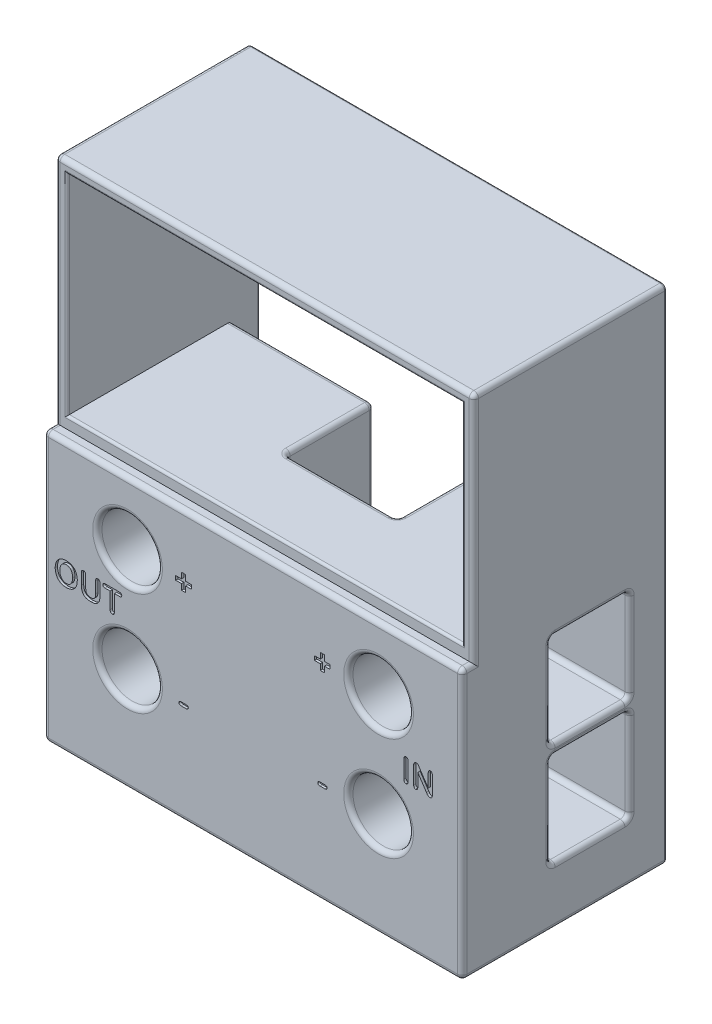
from build123d import *

# Parameters (mm, degrees)
SKETCH2_W               = 87.999717
SKETCH2_H               = 108
SKETCH2_R               = 6.5
SKETCH2_W_2             = 63.5
SKETCH2_H_2             = 21.25
BOSS_EXTRUDE1_DEPTH     = 46
SKETCH4_W               = 63.5
SKETCH4_H               = 21.25
BOSS_EXTRUDE2_DEPTH     = 44
BOSS_EXTRUDE3_START     = -10
SKETCH5_R               = 6.5
BOSS_EXTRUDE3_DEPTH     = 10
BOSS_EXTRUDE4_DEPTH     = 46
CUT_EXTRUDE1_START      = -45
SKETCH3_W               = 2
SKETCH3_H               = 20
CUT_EXTRUDE1_DEPTH      = 28
CUT_EXTRUDE2_START      = 45
SKETCH3_3_W             = 2
SKETCH3_3_H             = 20
CUT_EXTRUDE2_DEPTH      = 28
SKETCH6_W               = 85
SKETCH6_H               = 45
SKETCH6_W_2             = 63.5
SKETCH6_H_2             = 21.25
CUT_EXTRUDE4_DEPTH      = 85.00595217
SKETCH8_R               = 4.25
CUT_EXTRUDE5_DEPTH      = 79.974679487
SKETCH9_W               = 85
SKETCH9_H               = 103
CUT_EXTRUDE6_DEPTH      = 8
SKETCH6_4_W             = 90
SKETCH6_4_H             = 50
SKETCH6_4_W_2           = 85
SKETCH6_4_H_2           = 45
CUT_EXTRUDE7_DEPTH      = 2.5
CUT_EXTRUDE8_DEPTH      = 85.00595217
CUT_EXTRUDE8_DEPTH_BACK = 85.00595217
SKETCH10_W              = 2
SKETCH10_H              = 108
FILLET2_R               = 1
FILLET3_R               = 0.5
SKETCH11_W              = 24
SKETCH11_H              = 58
CUT_EXTRUDE9_DEPTH      = 19
FILLET4_R               = 1
CUT_EXTRUDE10_DEPTH     = 0.5


with BuildPart() as part:
    # Sketch2 → Boss-Extrude1 (new body)
    with BuildSketch(Plane.XY):
        Rectangle(SKETCH2_W, SKETCH2_H)
        with Locations((-27, -9.375)):
            Circle(SKETCH2_R, mode=Mode.SUBTRACT)
        with Locations((27, -9.375)):
            Circle(SKETCH2_R, mode=Mode.SUBTRACT)
        with Locations((27, -31.625)):
            Circle(SKETCH2_R, mode=Mode.SUBTRACT)
        with Locations((-27, -31.625)):
            Circle(SKETCH2_R, mode=Mode.SUBTRACT)
        with Locations((0, 32.5)):
            Rectangle(SKETCH2_W_2, SKETCH2_H_2, mode=Mode.SUBTRACT)
    extrude(amount=-BOSS_EXTRUDE1_DEPTH)

    # Sketch4 → Boss-Extrude2 (add)
    with BuildSketch(Plane(origin=(0, 0, -46), x_dir=(-1, 0, 0), z_dir=(0, 0, -1))):
        with Locations((0, 32.5)):
            Rectangle(SKETCH4_W, SKETCH4_H)
    extrude(amount=-BOSS_EXTRUDE2_DEPTH)

    # Sketch5 → Boss-Extrude3 (add)
    with BuildSketch(Plane(origin=(0, 0, -46), x_dir=(-1, 0, 0), z_dir=(0, 0, -1)).offset(BOSS_EXTRUDE3_START)):
        with Locations(Location((-27, -9.375, 0), (0, 0, 180))):
            Circle(SKETCH5_R)
        with Locations(Location((-27, -31.625, 0), (0, 0, 180))):
            Circle(SKETCH5_R)
        with Locations(Location((27, -31.625, 0), (0, 0, 180))):
            Circle(SKETCH5_R)
        with Locations(Location((27, -9.375, 0), (0, 0, 180))):
            Circle(SKETCH5_R)
    extrude(amount=BOSS_EXTRUDE3_DEPTH)

    # Sketch7 → Boss-Extrude4 (add)
    with BuildSketch(Plane.XY):
        Polygon((45, 54), (43.9998585, 52.7998302), (43.9998585, -54), (45, -54), align=None)
        Polygon((-45, 54), (-45, -54), (-43.9998585, -52.7998302), (-43.9998585, 54), align=None)
        Polygon((43.9998585, 54), (43.9998585, 52.7998302), (45, 54), align=None)
        Polygon((-43.9998585, -52.7998302), (-45, -54), (-43.9998585, -54), align=None)
    extrude(amount=-BOSS_EXTRUDE4_DEPTH)

    # Sketch3 → Cut-Extrude1 (cut)
    with BuildSketch(Plane(origin=(0, 0, 0), x_dir=(0, 0, -1), z_dir=(1, 0, 0)).offset(CUT_EXTRUDE1_START)):
        with BuildLine():
            Line((34, -1.125), (34, 0.625))
            Line((34, 0.625), (19, 0.625))
            Line((19, 0.625), (19, -19.375))
            Line((19, -19.375), (34, -19.375))
            Line((34, -19.375), (34, -17.625))
            ThreePointArc((34, -17.625), (27.5, -9.375), (34, -1.125))
        make_face()
        with Locations((35, -9.375)):
            Rectangle(SKETCH3_W, SKETCH3_H)
        with BuildLine():
            Line((34, -21.625), (19, -21.625))
            Line((19, -21.625), (19, -41.625))
            Line((19, -41.625), (34, -41.625))
            Line((34, -41.625), (34, -39.875))
            ThreePointArc((34, -39.875), (27.5, -31.625), (34, -23.375))
            Line((34, -23.375), (34, -21.625))
        make_face()
        with BuildLine():
            Line((34, -39.875), (34, -23.375))
            ThreePointArc((34, -23.375), (27.5, -31.625), (34, -39.875))
        make_face()
        with Locations((35, -31.625)):
            Rectangle(SKETCH3_W, SKETCH3_H)
        with BuildLine():
            Line((34, -17.625), (34, -1.125))
            ThreePointArc((34, -1.125), (27.5, -9.375), (34, -17.625))
        make_face()
    extrude(amount=CUT_EXTRUDE1_DEPTH, mode=Mode.SUBTRACT)

    # Sketch3<3> → Cut-Extrude2 (cut)
    with BuildSketch(Plane(origin=(0, 0, 0), x_dir=(0, 0, -1), z_dir=(1, 0, 0)).offset(CUT_EXTRUDE2_START)):
        with BuildLine():
            Line((34, -1.125), (34, 0.625))
            Line((34, 0.625), (19, 0.625))
            Line((19, 0.625), (19, -19.375))
            Line((19, -19.375), (34, -19.375))
            Line((34, -19.375), (34, -17.625))
            ThreePointArc((34, -17.625), (27.5, -9.375), (34, -1.125))
        make_face()
        with BuildLine():
            Line((34, -17.625), (34, -1.125))
            ThreePointArc((34, -1.125), (27.5, -9.375), (34, -17.625))
        make_face()
        with Locations((35, -9.375)):
            Rectangle(SKETCH3_3_W, SKETCH3_3_H)
        with Locations((35, -31.625)):
            Rectangle(SKETCH3_3_W, SKETCH3_3_H)
        with BuildLine():
            Line((34, -39.875), (34, -23.375))
            ThreePointArc((34, -23.375), (27.5, -31.625), (34, -39.875))
        make_face()
        with BuildLine():
            Line((34, -21.625), (19, -21.625))
            Line((19, -21.625), (19, -41.625))
            Line((19, -41.625), (34, -41.625))
            Line((34, -41.625), (34, -39.875))
            ThreePointArc((34, -39.875), (27.5, -31.625), (34, -23.375))
            Line((34, -23.375), (34, -21.625))
        make_face()
    extrude(amount=-CUT_EXTRUDE2_DEPTH, mode=Mode.SUBTRACT)

    # Sketch6 → Cut-Extrude4 (cut, through all)
    # profile 1 of 2: a face of its own
    with BuildSketch(Plane.XY):
        with Locations((0, 29)):
            Rectangle(SKETCH6_W, SKETCH6_H)
        with Locations((0, 32.5)):
            Rectangle(SKETCH6_W_2, SKETCH6_H_2, mode=Mode.SUBTRACT)
    # profile 2 of 2: a face of its own
    with BuildSketch(Plane.XY):
        with Locations((0, 32.5)):
            Rectangle(SKETCH6_W_2, SKETCH6_H_2)
    extrude(amount=-CUT_EXTRUDE4_DEPTH, mode=Mode.SUBTRACT)

    # Sketch8 → Cut-Extrude5 (cut, through all)
    with BuildSketch(Plane.XY.offset(-36)):
        with Locations((-27, -9.375)):
            Circle(SKETCH8_R)
        with Locations((-27, -31.625)):
            Circle(SKETCH8_R)
        with Locations((27, -31.625)):
            Circle(SKETCH8_R)
        with Locations((27, -9.375)):
            Circle(SKETCH8_R)
    extrude(amount=-CUT_EXTRUDE5_DEPTH, mode=Mode.SUBTRACT)

    # Sketch9 → Cut-Extrude6 (cut)
    with BuildSketch(Plane(origin=(0, 0, -46), x_dir=(-1, 0, 0), z_dir=(0, 0, -1))):
        Rectangle(SKETCH9_W, SKETCH9_H)
    extrude(amount=-CUT_EXTRUDE6_DEPTH, mode=Mode.SUBTRACT)

    # Sketch6<4> → Cut-Extrude7 (cut)
    with BuildSketch(Plane.XY):
        with Locations((0, 29)):
            Rectangle(SKETCH6_4_W, SKETCH6_4_H)
        with Locations((0, 29)):
            Rectangle(SKETCH6_4_W_2, SKETCH6_4_H_2, mode=Mode.SUBTRACT)
    extrude(amount=-CUT_EXTRUDE7_DEPTH, mode=Mode.SUBTRACT)

    # Sketch10 → Cut-Extrude8 (cut, two sides: drawn at the far end of the back side and taken through both)
    with BuildSketch(Plane(origin=(0, 0, 0), x_dir=(0, 0, -1), z_dir=(1, 0, 0)).offset(-CUT_EXTRUDE8_DEPTH_BACK)):
        with Locations((45, 0)):
            Rectangle(SKETCH10_W, SKETCH10_H)
    extrude(amount=CUT_EXTRUDE8_DEPTH + CUT_EXTRUDE8_DEPTH_BACK, mode=Mode.SUBTRACT)

    # Fillet2
    fillet2_edges = [part.edges().sort_by_distance(p)[0] for p in [
        (-17, -31.625, -19),
        (-31, -21.625, -19),
        (-33.5, -31.625, -19),
        (-17, -31.625, -36),
        (-31, -41.625, -36),
        (-17, -41.625, -27.5),
        (-31, -41.625, -19),
        (-45, -21.625, -27.5),
        (-31, -21.625, -36),
        (-17, -21.625, -27.5),
        (-45, -31.625, -19),
        (-45, -31.625, -36),
        (-45, -41.625, -27.5),
        (-45, -9.375, -19),
        (-31, 0.625, -19),
        (-45, -9.375, -36),
        (-31, -19.375, -36),
        (-33.5, -9.375, -19),
        (-17, -19.375, -27.5),
        (-31, -19.375, -19),
        (-45, 0.625, -27.5),
        (-31, 0.625, -36),
        (-17, -9.375, -19),
        (-17, -9.375, -36),
        (-17, 0.625, -27.5),
        (-45, -19.375, -27.5),
        (45, -9.375, -36),
        (31, 0.625, -36),
        (45, -9.375, -19),
        (31, -19.375, -19),
        (17, -19.375, -27.5),
        (31, -19.375, -36),
        (20.5, -9.375, -19),
        (45, 0.625, -27.5),
        (31, 0.625, -19),
        (17, -9.375, -36),
        (17, -9.375, -19),
        (17, 0.625, -27.5),
        (45, -19.375, -27.5),
        (17, -31.625, -19),
        (31, -41.625, -19),
        (20.5, -31.625, -19),
        (17, -31.625, -36),
        (31, -21.625, -36),
        (45, -41.625, -27.5),
        (31, -41.625, -36),
        (17, -21.625, -27.5),
        (31, -21.625, -19),
        (17, -41.625, -27.5),
        (45, -31.625, -36),
        (45, -21.625, -27.5),
        (45, -31.625, -19),
        (0, -54, 0),
        (22.75, -9.375, -36),
        (20.5, -31.625, 0),
        (22.75, -31.625, -36),
        (-31.25, -31.625, -36),
        (-31.25, -9.375, -36),
        (20.5, -9.375, 0),
        (-33.5, -31.625, 0),
        (-33.5, -9.375, 0),
        (0, 6.5, -38),
        (-45, -25, 0),
        (45, -25, 0),
        (-45, 29, -2.5),
        (-45, 4, -1.25),
        (0, 54, -2.5),
        (45, 29, -2.5),
        (45, 4, -1.25),
        (0, 4, 0),
        (-45, -54, -22),
        (45, -54, -22),
        (-45, 54, -23.25),
        (45, 54, -23.25),
    ]]
    fillet(fillet2_edges, radius=FILLET2_R)

    # Fillet3
    fillet3_edges = [part.edges().sort_by_distance(p)[0] for p in [
        (22.75, -31.625, -38),
        (22.75, -9.375, -38),
        (-31.25, -9.375, -38),
        (-31.25, -31.625, -38),
        (0, 51.5, -2.5),
        (-42.5, 29, -2.5),
        (0, 6.5, -2.5),
        (42.5, 29, -2.5),
        (0, -51.5, -44),
        (42.5, 0, -44),
        (0, 51.5, -44),
        (-42.5, 0, -44),
        (-45, 0, -44),
        (45, 0, -44),
        (0, -54, -44),
        (0, 54, -44),
        (44.707106781, 53.707106781, -44),
        (-44.707106781, 53.707106781, -44),
        (-44.707106781, -53.707106781, -44),
        (44.707106781, -53.707106781, -44),
    ]]
    fillet(fillet3_edges, radius=FILLET3_R)

    # Sketch11 → Cut-Extrude9 (cut)
    with BuildSketch(Plane(origin=(0, 0, -38), x_dir=(-1, 0, 0), z_dir=(0, 0, -1))):
        with Locations((0, -22.5)):
            Rectangle(SKETCH11_W, SKETCH11_H)
    extrude(amount=-CUT_EXTRUDE9_DEPTH, mode=Mode.SUBTRACT)

    # Fillet4
    fillet4_edges = [part.edges().sort_by_distance(p)[0] for p in [
        (12, 6.207106781, -37.707106781),
        (-12, 6.207106781, -37.707106781),
        (-12, -23, -38),
        (12, -23, -38),
        (-12, 6.5, -28),
        (12, 6.5, -28),
        (-12, -22.5, -19),
        (0, -51.5, -19),
        (12, -22.5, -19),
        (0, 6.5, -19),
    ]]
    fillet(fillet4_edges, radius=FILLET4_R)

    # Sketch12 → Cut-Extrude10 (cut)
    # profile 1 of 9: a face of its own
    with BuildSketch(Plane.XY):
        with BuildLine():
            add(Edge.make_bspline(
                [(-40.204101563, -18.0625), (-40.142219014, -18.063368709), (-40.020879099, -18.065072082), (-39.842278019, -18.0805127), (-39.670025809, -18.103431299), (-39.504239086, -18.136420072), (-39.345329126, -18.179465633), (-39.193265668, -18.232369375), (-39.047852761, -18.294956068), (-38.908920342, -18.365997783), (-38.77799459, -18.446416769), (-38.654241911, -18.534359089), (-38.539064026, -18.631114909), (-38.43219245, -18.735834907), (-38.334309043, -18.848804815), (-38.243990785, -18.969397378), (-38.161933411, -19.098290949), (-38.089020705, -19.23545814), (-38.023513565, -19.378849399), (-37.966648985, -19.528884986), (-37.919187553, -19.684929266), (-37.879709879, -19.847240726), (-37.849789796, -20.015581804), (-37.828714559, -20.190346757), (-37.81412411, -20.370846257), (-37.813046628, -20.493459783), (-37.8125, -20.555664063)],
                knots=[0, 0, 0, 0, 1.137132438, 2.22970057, 3.292424762, 4.329649132, 5.333981859, 6.315987487, 7.286185149, 8.241436353, 9.181332131, 10.107725602, 11.0292572, 11.943085262, 12.854854597, 13.773819033, 14.709898734, 15.660115542, 16.626635295, 17.605574315, 18.606712189, 19.622473761, 20.67399022, 21.747038223, 22.857027702, 24, 24, 24, 24], degree=3))
            add(Edge.make_bspline(
                [(-37.8125, -20.555664063), (-37.814407642, -20.646879139), (-37.818150658, -20.825853777), (-37.846542647, -21.087869401), (-37.894672643, -21.337285549), (-37.96022212, -21.574001048), (-38.046378281, -21.796377097), (-38.151196568, -22.00412166), (-38.275708195, -22.196231979), (-38.418571732, -22.372534386), (-38.57924091, -22.5320302), (-38.758813404, -22.671073825), (-38.956175636, -22.789747841), (-39.169574475, -22.889709328), (-39.400288076, -22.968467406), (-39.647849295, -23.021416856), (-39.910729065, -23.057454879), (-40.09166815, -23.060788415), (-40.184570313, -23.0625)],
                knots=[0, 0, 0, 0, 1.119700056, 2.196982321, 3.230778928, 4.235358115, 5.208318876, 6.153781848, 7.087131445, 8.013361148, 8.934611457, 9.860297843, 10.794468433, 11.756326826, 12.748403726, 13.780058436, 14.860183413, 16, 16, 16, 16], degree=3))
            add(Edge.make_bspline(
                [(-40.184570313, -23.0625), (-40.276803124, -23.06027942), (-40.457365589, -23.055932231), (-40.720582827, -23.021097135), (-40.969461773, -22.965059913), (-41.20258146, -22.884937151), (-41.418313513, -22.78290435), (-41.617562497, -22.664138614), (-41.796462748, -22.523837845), (-41.957312206, -22.366006832), (-42.100098053, -22.190396648), (-42.221488428, -21.996136894), (-42.328544833, -21.787455566), (-42.413165738, -21.561257329), (-42.480490707, -21.32244949), (-42.5279401, -21.072812122), (-42.556870777, -20.813835192), (-42.56060378, -20.638096536), (-42.5625, -20.548828125)],
                knots=[0, 0, 0, 0, 1.130091603, 2.212359386, 3.247930852, 4.252250901, 5.226719473, 6.16821431, 7.089197795, 8.00610207, 8.925165125, 9.855999165, 10.808795857, 11.79501972, 12.810514548, 13.846493258, 14.906102224, 16, 16, 16, 16], degree=3))
            add(Edge.make_bspline(
                [(-42.5625, -20.548828125), (-42.560779931, -20.457917793), (-42.557397661, -20.279155552), (-42.52617064, -20.017250939), (-42.476867474, -19.76650569), (-42.406593898, -19.528182138), (-42.317493046, -19.303954514), (-42.20934334, -19.096268157), (-42.084128705, -18.905766816), (-41.941020547, -18.732813051), (-41.779791607, -18.578459843), (-41.601343885, -18.443470626), (-41.406555768, -18.327351299), (-41.195418304, -18.231841316), (-40.968892091, -18.155181952), (-40.727036042, -18.101058131), (-40.470304863, -18.068269124), (-40.294370818, -18.064456304), (-40.204101563, -18.0625)],
                knots=[0, 0, 0, 0, 1.125218611, 2.212582392, 3.260701818, 4.286054269, 5.284468473, 6.243521648, 7.180287843, 8.101949555, 9.017004541, 9.937572836, 10.866572707, 11.818894766, 12.801573564, 13.82236102, 14.882684417, 16, 16, 16, 16], degree=3))
        make_face()
        with BuildLine():
            add(Edge.make_bspline(
                [(-38.8125, -20.548828125), (-38.814409711, -20.461806319), (-38.818107355, -20.293311934), (-38.850878723, -20.049572404), (-38.903958219, -19.823491976), (-38.967222357, -19.648437478), (-39.027971578, -19.51867883), (-39.077585349, -19.428366426), (-39.130955162, -19.343341598), (-39.191528722, -19.266437061), (-39.254362066, -19.193984208), (-39.322390378, -19.127691549), (-39.395732164, -19.068546163), (-39.498508546, -18.996758293), (-39.636913927, -18.922373447), (-39.815617192, -18.858633433), (-40.006108222, -18.819354309), (-40.137179526, -18.814816767), (-40.204101563, -18.8125)],
                knots=[0, 0, 0, 0, 1.663767962, 3.22144036, 4.693807908, 6.09809827, 6.772124886, 7.43249818, 8.068074837, 8.689496673, 9.30272399, 9.901527182, 10.503429657, 11.102750509, 12.297797107, 13.495176895, 14.721094103, 16, 16, 16, 16], degree=3))
            add(Edge.make_bspline(
                [(-40.204101563, -18.8125), (-40.252038776, -18.813692449), (-40.346782105, -18.816049209), (-40.485861893, -18.838431131), (-40.619461179, -18.87343406), (-40.746958383, -18.922391316), (-40.86721804, -18.984912243), (-40.979702156, -19.060816842), (-41.083054339, -19.149809619), (-41.177853092, -19.25153021), (-41.263531901, -19.367003595), (-41.339544956, -19.497427585), (-41.40577496, -19.642803935), (-41.462238579, -19.801835484), (-41.506895778, -19.973704465), (-41.538649307, -20.156608918), (-41.558596828, -20.349495293), (-41.561179593, -20.481395653), (-41.5625, -20.548828125)],
                knots=[0, 0, 0, 0, 0.926902171, 1.831933723, 2.71800685, 3.595261319, 4.468550136, 5.334998465, 6.214894287, 7.1017058, 8.020008637, 8.99111482, 10.01694856, 11.106630737, 12.25237115, 13.448355624, 14.695502513, 16, 16, 16, 16], degree=3))
            add(Edge.make_bspline(
                [(-41.5625, -20.548828125), (-41.561175948, -20.616910417), (-41.558585554, -20.750107531), (-41.538678745, -20.94495126), (-41.506717933, -21.130076126), (-41.462379635, -21.304715937), (-41.405018449, -21.466834698), (-41.336159513, -21.614946915), (-41.258965571, -21.750109054), (-41.167899319, -21.868552345), (-41.069532555, -21.973072777), (-40.963817326, -22.06410939), (-40.851516456, -22.141662991), (-40.731554552, -22.204799085), (-40.604589267, -22.252170855), (-40.472024127, -22.288072541), (-40.332998529, -22.308578568), (-40.238345748, -22.311182043), (-40.190429688, -22.3125)],
                knots=[0, 0, 0, 0, 1.300369924, 2.54406124, 3.737115199, 4.88637188, 5.981883645, 7.016846829, 8.003376514, 8.948590554, 9.863559023, 10.741055788, 11.608647785, 12.46534091, 13.323432129, 14.192248925, 15.0848625, 16, 16, 16, 16], degree=3))
            add(Edge.make_bspline(
                [(-40.190429688, -22.3125), (-40.128714879, -22.310432989), (-40.007115757, -22.306360277), (-39.829062488, -22.268333598), (-39.65894479, -22.208545464), (-39.524248456, -22.139704674), (-39.422731166, -22.071892244), (-39.349371171, -22.014681888), (-39.281172171, -21.949579237), (-39.216166088, -21.879097392), (-39.155929432, -21.801699497), (-39.098897641, -21.718367101), (-39.046241602, -21.628209325), (-38.997525615, -21.53173024), (-38.95353172, -21.42910536), (-38.915158866, -21.320607226), (-38.884568811, -21.205758865), (-38.857870644, -21.085626874), (-38.837560064, -20.959421065), (-38.823117244, -20.827745953), (-38.814067885, -20.690231108), (-38.81303074, -20.596694032), (-38.8125, -20.548828125)],
                knots=[0, 0, 0, 0, 1.468568495, 2.893578421, 4.316075305, 5.755382189, 6.482330971, 7.222315454, 7.968369796, 8.725783183, 9.504530818, 10.302500265, 11.129737207, 11.9897977, 12.875655565, 13.787998707, 14.728608307, 15.705132475, 16.718642732, 17.771954593, 18.859838044, 20, 20, 20, 20], degree=3))
        make_face(mode=Mode.SUBTRACT)
    # profile 2 of 9: a face of its own
    with BuildSketch(Plane.XY):
        with BuildLine():
            Line((-36.9375, -20.981445313), (-36.9375, -18.65625))
            add(Edge.make_bspline(
                [(-36.9375, -18.65625), (-36.936347915, -18.609560537), (-36.934186191, -18.521954458), (-36.909347602, -18.399701183), (-36.870478375, -18.295100271), (-36.81330714, -18.209823291), (-36.743514772, -18.143210616), (-36.661901868, -18.096558932), (-36.571075194, -18.066512432), (-36.506755039, -18.06386389), (-36.473632813, -18.0625)],
                knots=[0, 0, 0, 0, 1.314006093, 2.465543923, 3.499702682, 4.438645347, 5.334276599, 6.193453487, 7.069703068, 8, 8, 8, 8], degree=3))
            add(Edge.make_bspline(
                [(-36.473632813, -18.0625), (-36.438939423, -18.064363054), (-36.372286212, -18.067942368), (-36.277450995, -18.095840638), (-36.194605213, -18.143871779), (-36.123835804, -18.210848219), (-36.067342536, -18.296948281), (-36.027775176, -18.402193177), (-36.003534117, -18.525270354), (-36.001222859, -18.613483661), (-36, -18.66015625)],
                knots=[0, 0, 0, 0, 0.96282878, 1.849794185, 2.716851436, 3.599658085, 4.532680285, 5.552030856, 6.704809248, 8, 8, 8, 8], degree=3))
            Line((-36, -18.66015625), (-36, -21.053710938))
            add(Edge.make_bspline(
                [(-36, -21.053710938), (-35.99889066, -21.119176272), (-35.996767426, -21.244474345), (-35.980352355, -21.424389171), (-35.952620356, -21.587521133), (-35.913468807, -21.734879035), (-35.858654871, -21.866513437), (-35.785781742, -21.982442862), (-35.694423845, -22.082436057), (-35.604389303, -22.152348162), (-35.523320188, -22.198607116), (-35.455881093, -22.22899436), (-35.38297238, -22.255675736), (-35.303537405, -22.275251537), (-35.21924944, -22.292442399), (-35.128794967, -22.303466192), (-35.032714084, -22.312002141), (-34.966492651, -22.312331511), (-34.932617188, -22.3125)],
                knots=[0, 0, 0, 0, 1.640841622, 3.140506311, 4.523579023, 5.784571649, 6.954579444, 8.084197464, 9.198982671, 10.333306227, 10.925380769, 11.535182691, 12.185613052, 12.868404783, 13.583722754, 14.340779317, 15.151228418, 16, 16, 16, 16], degree=3))
            add(Edge.make_bspline(
                [(-34.932617188, -22.3125), (-34.886018292, -22.311674313), (-34.796154634, -22.310082015), (-34.666915353, -22.294831437), (-34.547810982, -22.27254376), (-34.439976213, -22.237904472), (-34.342004443, -22.195029342), (-34.254772573, -22.142425249), (-34.177901824, -22.079862251), (-34.111987738, -22.006889167), (-34.056360614, -21.923270422), (-34.007144985, -21.831202928), (-33.966579922, -21.728768874), (-33.932253732, -21.61717405), (-33.906095076, -21.495290392), (-33.887966427, -21.363741724), (-33.877290695, -21.222181646), (-33.875781426, -21.124693418), (-33.875, -21.07421875)],
                knots=[0, 0, 0, 0, 1.187087794, 2.289239917, 3.312641325, 4.270309596, 5.169103343, 6.032749862, 6.858132282, 7.686303516, 8.528484611, 9.411791075, 10.342302716, 11.33164497, 12.384483705, 13.515514569, 14.713654137, 16, 16, 16, 16], degree=3))
            Line((-33.875, -21.07421875), (-33.875, -18.66015625))
            add(Edge.make_bspline(
                [(-33.875, -18.66015625), (-33.873685282, -18.612853927), (-33.871218239, -18.524091977), (-33.848475161, -18.400133957), (-33.808724112, -18.295398446), (-33.752835216, -18.209945927), (-33.683718699, -18.142612396), (-33.601499713, -18.096857609), (-33.509937038, -18.066252371), (-33.444926434, -18.063783409), (-33.411132813, -18.0625)],
                knots=[0, 0, 0, 0, 1.324209478, 2.484855026, 3.512713035, 4.440887327, 5.324452051, 6.186293477, 7.057204391, 8, 8, 8, 8], degree=3))
            add(Edge.make_bspline(
                [(-33.411132813, -18.0625), (-33.377364158, -18.063865071), (-33.311778592, -18.066516314), (-33.21904633, -18.096543029), (-33.135875484, -18.142868959), (-33.064442019, -18.209061932), (-33.00544498, -18.293736648), (-32.965148551, -18.399135464), (-32.941017171, -18.522664676), (-32.938719595, -18.611204538), (-32.9375, -18.658203125)],
                knots=[0, 0, 0, 0, 0.937671153, 1.821147261, 2.686184232, 3.571984669, 4.510357278, 5.535961965, 6.692043289, 8, 8, 8, 8], degree=3))
            Line((-32.9375, -18.658203125), (-32.9375, -20.9921875))
            add(Edge.make_bspline(
                [(-32.9375, -20.9921875), (-32.938814946, -21.083039659), (-32.941339732, -21.257482084), (-32.960267279, -21.507426996), (-32.993362685, -21.733860143), (-33.038094829, -21.939597905), (-33.102992598, -22.128276032), (-33.192235417, -22.30285969), (-33.3043956, -22.466365378), (-33.396080085, -22.562684701), (-33.442382813, -22.611328125)],
                knots=[0, 0, 0, 0, 1.248457049, 2.397123805, 3.441600438, 4.391152342, 5.286682789, 6.174943873, 7.078305605, 8, 8, 8, 8], degree=3))
            add(Edge.make_bspline(
                [(-33.442382813, -22.611328125), (-33.486816817, -22.648867023), (-33.575580817, -22.72385695), (-33.723495667, -22.817039267), (-33.880907486, -22.896203445), (-34.049981491, -22.958697173), (-34.231695061, -23.005474425), (-34.42711508, -23.037961431), (-34.636914453, -23.058930849), (-34.781848334, -23.061287196), (-34.856445313, -23.0625)],
                knots=[0, 0, 0, 0, 0.917673777, 1.83319953, 2.752815171, 3.696261941, 4.673826777, 5.7116717, 6.822205161, 8, 8, 8, 8], degree=3))
            add(Edge.make_bspline(
                [(-34.856445313, -23.0625), (-34.945041021, -23.061054572), (-35.11602359, -23.058265014), (-35.362992947, -23.035453679), (-35.59115974, -22.999491216), (-35.80038398, -22.946707796), (-35.991758558, -22.879304535), (-36.163349314, -22.792178873), (-36.319002206, -22.691987195), (-36.454850533, -22.572271952), (-36.573259477, -22.435920236), (-36.674960776, -22.282188342), (-36.757035815, -22.109682213), (-36.825457088, -21.920505185), (-36.87453983, -21.712198793), (-36.912072948, -21.485854188), (-36.932824061, -21.239967141), (-36.93590376, -21.069697737), (-36.9375, -20.981445313)],
                knots=[0, 0, 0, 0, 1.244583114, 2.401944964, 3.48169555, 4.486712429, 5.430003149, 6.325898902, 7.184706889, 8.024138875, 8.860562605, 9.715550095, 10.605366032, 11.538500779, 12.536866304, 13.60758979, 14.759988597, 16, 16, 16, 16], degree=3))
        make_face()
    # profile 3 of 9: a face of its own
    with BuildSketch(Plane.XY):
        with BuildLine():
            Line((-28.745117188, -19), (-29.8125, -19))
            Line((-29.8125, -19), (-29.8125, -22.47265625))
            add(Edge.make_bspline(
                [(-29.8125, -22.47265625), (-29.813657073, -22.519665199), (-29.815821135, -22.607585544), (-29.840444898, -22.730371911), (-29.880326392, -22.834692417), (-29.938406433, -22.918913784), (-30.008809833, -22.983769579), (-30.090108837, -23.029549039), (-30.181052362, -23.058224996), (-30.24522422, -23.0610454), (-30.278320313, -23.0625)],
                knots=[0, 0, 0, 0, 1.324771526, 2.4777063, 3.516495944, 4.454151167, 5.338361256, 6.19400724, 7.068574513, 8, 8, 8, 8], degree=3))
            add(Edge.make_bspline(
                [(-30.278320313, -23.0625), (-30.311785823, -23.061172111), (-30.376777519, -23.058593283), (-30.468397513, -23.028011397), (-30.551928478, -22.98331378), (-30.622940466, -22.916801763), (-30.682108754, -22.832713736), (-30.72067972, -22.727778171), (-30.746982853, -22.606447162), (-30.748953809, -22.519048027), (-30.75, -22.47265625)],
                knots=[0, 0, 0, 0, 0.936591527, 1.818907611, 2.686883908, 3.580272073, 4.52668274, 5.549195867, 6.699104295, 8, 8, 8, 8], degree=3))
            Line((-30.75, -22.47265625), (-30.75, -19))
            Line((-30.75, -19), (-31.818359375, -19))
            add(Edge.make_bspline(
                [(-31.818359375, -19), (-31.857558989, -18.999027325), (-31.931105492, -18.997202388), (-32.033183239, -18.975092322), (-32.120787236, -18.941882109), (-32.191671431, -18.891924127), (-32.245912788, -18.830486748), (-32.285529969, -18.760081709), (-32.308075229, -18.680390244), (-32.310996015, -18.624488378), (-32.3125, -18.595703125)],
                knots=[0, 0, 0, 0, 1.298175259, 2.435642608, 3.448405227, 4.386245553, 5.281324188, 6.14672195, 7.045701294, 8, 8, 8, 8], degree=3))
            add(Edge.make_bspline(
                [(-32.3125, -18.595703125), (-32.311247918, -18.565554112), (-32.308833523, -18.507417629), (-32.283329306, -18.425945796), (-32.243636614, -18.353897492), (-32.186560863, -18.293822576), (-32.114862047, -18.245009031), (-32.028070201, -18.211391908), (-31.927722451, -18.190746532), (-31.856231461, -18.188624264), (-31.818359375, -18.1875)],
                knots=[0, 0, 0, 0, 0.993926626, 1.916593339, 2.793690024, 3.692250099, 4.629614642, 5.63892321, 6.749228366, 8, 8, 8, 8], degree=3))
            Line((-31.818359375, -18.1875), (-28.745117188, -18.1875))
            add(Edge.make_bspline(
                [(-28.745117188, -18.1875), (-28.705275506, -18.188508285), (-28.630456794, -18.190401743), (-28.52655638, -18.212087944), (-28.437800612, -18.246313023), (-28.367301212, -18.297922779), (-28.311178966, -18.358681581), (-28.272670556, -18.430396477), (-28.248088606, -18.510125573), (-28.245485907, -18.566542407), (-28.244140625, -18.595703125)],
                knots=[0, 0, 0, 0, 1.304496451, 2.449714448, 3.464685333, 4.39788137, 5.28974218, 6.154486031, 7.046091257, 8, 8, 8, 8], degree=3))
            add(Edge.make_bspline(
                [(-28.244140625, -18.595703125), (-28.245556319, -18.624509871), (-28.248310157, -18.680545355), (-28.272174801, -18.760180811), (-28.312729287, -18.830547282), (-28.367969961, -18.89196525), (-28.439818128, -18.94187864), (-28.528657631, -18.975240046), (-28.631760922, -18.997026322), (-28.705927235, -18.998971929), (-28.745117188, -19)],
                knots=[0, 0, 0, 0, 0.94771637, 1.843517728, 2.708217129, 3.604275273, 4.544436114, 5.560171289, 6.710778986, 8, 8, 8, 8], degree=3))
        make_face()
    # profile 4 of 9: a face of its own
    with BuildSketch(Plane.XY):
        with BuildLine():
            Line((32.4375, -22.465820313), (32.4375, -18.65625))
            add(Edge.make_bspline(
                [(32.4375, -18.65625), (32.438643547, -18.609554715), (32.440789249, -18.521937711), (32.465733108, -18.39975622), (32.504325843, -18.294751077), (32.562775756, -18.210113201), (32.632401848, -18.143169865), (32.714091115, -18.096570131), (32.804584088, -18.066611246), (32.868573218, -18.063893054), (32.901367187, -18.0625)],
                knots=[0, 0, 0, 0, 1.314663, 2.466776515, 3.501452278, 4.446007437, 5.34208644, 6.201692853, 7.078380494, 8, 8, 8, 8], degree=3))
            add(Edge.make_bspline(
                [(32.901367187, -18.0625), (32.935135716, -18.063865122), (33.000721037, -18.066516466), (33.093455042, -18.096542467), (33.17661943, -18.142871041), (33.248077981, -18.209053741), (33.306798442, -18.293520353), (33.34741112, -18.398101806), (33.371534885, -18.521032872), (33.373795616, -18.609252046), (33.375, -18.65625)],
                knots=[0, 0, 0, 0, 0.939704012, 1.825095485, 2.692007845, 3.579728686, 4.520135675, 5.539530793, 6.689207656, 8, 8, 8, 8], degree=3))
            Line((33.375, -18.65625), (33.375, -22.465820313))
            add(Edge.make_bspline(
                [(33.375, -22.465820313), (33.373805235, -22.512819272), (33.37156256, -22.601040335), (33.347261779, -22.724256909), (33.306749817, -22.82939308), (33.248449526, -22.91498494), (33.176278301, -22.980853961), (33.093956455, -23.029009161), (33.000432773, -23.056885259), (32.935079764, -23.060589272), (32.901367187, -23.0625)],
                knots=[0, 0, 0, 0, 1.307751878, 2.454761992, 3.480206064, 4.425894871, 5.311556588, 6.180961951, 7.061642901, 8, 8, 8, 8], degree=3))
            add(Edge.make_bspline(
                [(32.901367187, -23.0625), (32.868958253, -23.060558866), (32.805849946, -23.056778993), (32.715428305, -23.029033521), (32.635454587, -22.979972006), (32.56442116, -22.9140444), (32.505147213, -22.828460081), (32.467193553, -22.722447896), (32.440376435, -22.600287941), (32.438499535, -22.512546578), (32.4375, -22.465820313)],
                knots=[0, 0, 0, 0, 0.912572231, 1.777006537, 2.632638816, 3.534642503, 4.491136576, 5.533474522, 6.686463005, 8, 8, 8, 8], degree=3))
        make_face()
    # profile 5 of 9: a face of its own
    with BuildSketch(Plane.XY):
        with BuildLine():
            Line((35.787109375, -18.649414063), (37.6875, -21.5))
            Line((37.6875, -21.5), (37.6875, -18.623046875))
            add(Edge.make_bspline(
                [(37.6875, -18.623046875), (37.688967089, -18.579010182), (37.691715012, -18.496527494), (37.712591005, -18.380878978), (37.74917017, -18.282776521), (37.801005478, -18.20221468), (37.865452464, -18.139204827), (37.941547557, -18.094442008), (38.027794079, -18.067009974), (38.088659627, -18.064036698), (38.120117188, -18.0625)],
                knots=[0, 0, 0, 0, 1.319117216, 2.470765316, 3.505116792, 4.43580569, 5.318756254, 6.18027265, 7.059497782, 8, 8, 8, 8], degree=3))
            add(Edge.make_bspline(
                [(38.120117188, -18.0625), (38.152531882, -18.064065554), (38.215273445, -18.067095825), (38.304001596, -18.093969467), (38.381550309, -18.139196897), (38.447017136, -18.202122215), (38.499797352, -18.28268682), (38.537660955, -18.380669347), (38.558201659, -18.496555875), (38.561003907, -18.57902006), (38.5625, -18.623046875)],
                knots=[0, 0, 0, 0, 0.959871134, 1.857917088, 2.719075999, 3.600089629, 4.526699118, 5.554128738, 6.694173474, 8, 8, 8, 8], degree=3))
            Line((38.5625, -18.623046875), (38.5625, -22.42578125))
            add(Edge.make_bspline(
                [(38.5625, -22.42578125), (38.561293623, -22.475696837), (38.559029392, -22.569382615), (38.534906572, -22.700379865), (38.494225141, -22.811882756), (38.437305638, -22.904397618), (38.362391295, -22.976980916), (38.269778573, -23.026870963), (38.161798711, -23.058030745), (38.084539552, -23.060960579), (38.043945312, -23.0625)],
                knots=[0, 0, 0, 0, 1.276164049, 2.395212213, 3.391561633, 4.297456637, 5.151673506, 6.027862746, 6.963780962, 8, 8, 8, 8], degree=3))
            add(Edge.make_bspline(
                [(38.043945312, -23.0625), (38.002789087, -23.060568961), (37.923409742, -23.056844502), (37.809055553, -23.02965263), (37.705082087, -22.978923283), (37.611659905, -22.90557179), (37.524201899, -22.816608833), (37.444148006, -22.713420226), (37.368725794, -22.601624608), (37.31710543, -22.526334263), (37.291015625, -22.48828125)],
                knots=[0, 0, 0, 0, 0.990229924, 1.909888509, 2.806876858, 3.75171819, 4.754420985, 5.802993103, 6.889595585, 8, 8, 8, 8], degree=3))
            Line((37.291015625, -22.48828125), (35.4375, -19.6875))
            Line((35.4375, -19.6875), (35.4375, -22.504882813))
            add(Edge.make_bspline(
                [(35.4375, -22.504882813), (35.436036307, -22.547938792), (35.433263701, -22.629497779), (35.411855241, -22.744183748), (35.372471416, -22.842106499), (35.318360969, -22.922634501), (35.251913254, -22.985290653), (35.175949163, -23.030398667), (35.090705587, -23.057908316), (35.030805512, -23.060940568), (35, -23.0625)],
                knots=[0, 0, 0, 0, 1.293064309, 2.449392962, 3.484384031, 4.441729672, 5.340986808, 6.204611779, 7.076664708, 8, 8, 8, 8], degree=3))
            add(Edge.make_bspline(
                [(35, -23.0625), (34.968539892, -23.060998934), (34.907259618, -23.058075048), (34.820516547, -23.029815038), (34.744224961, -22.983177012), (34.677600434, -22.920167138), (34.625760233, -22.838120196), (34.588733065, -22.740192856), (34.566493997, -22.626306887), (34.563883519, -22.545029234), (34.5625, -22.501953125)],
                knots=[0, 0, 0, 0, 0.938889884, 1.828837584, 2.693878765, 3.596100726, 4.546832571, 5.570326044, 6.712304089, 8, 8, 8, 8], degree=3))
            Line((34.5625, -22.501953125), (34.5625, -18.771484375))
            add(Edge.make_bspline(
                [(34.5625, -18.771484375), (34.562866376, -18.734013867), (34.563559158, -18.663160664), (34.573805999, -18.563394484), (34.587808296, -18.4755907), (34.60516579, -18.423017833), (34.61328125, -18.3984375)],
                knots=[0, 0, 0, 0, 1.18793306, 2.246269525, 3.180047019, 4, 4, 4, 4], degree=3))
            add(Edge.make_bspline(
                [(34.61328125, -18.3984375), (34.624171136, -18.374519786), (34.645912187, -18.326769403), (34.693585215, -18.263498293), (34.747997085, -18.204529475), (34.81366266, -18.15594809), (34.884514081, -18.114658781), (34.959655854, -18.084142498), (35.038189814, -18.06582318), (35.09137625, -18.063613118), (35.118164062, -18.0625)],
                knots=[0, 0, 0, 0, 0.980600708, 1.957714689, 2.948627098, 3.97434472, 5.000279326, 6.011426356, 6.998437519, 8, 8, 8, 8], degree=3))
            add(Edge.make_bspline(
                [(35.118164062, -18.0625), (35.158192841, -18.064092522), (35.233254113, -18.067078791), (35.336754319, -18.101647792), (35.424863608, -18.152322857), (35.501056635, -18.221492432), (35.57309913, -18.30697701), (35.639869357, -18.412366203), (35.71217371, -18.52814521), (35.761749808, -18.608374517), (35.787109375, -18.649414063)],
                knots=[0, 0, 0, 0, 1.01695463, 1.906975685, 2.751376853, 3.592506721, 4.517315556, 5.594915983, 6.76973195, 8, 8, 8, 8], degree=3))
        make_face()
    # profile 6 of 9: a face of its own
    with BuildSketch(Plane.XY):
        Polygon((-14.522682188, -11.1875), (-15.397682188, -11.1875), (-15.397682188, -9.9375), (-16.659400938, -9.9375), (-16.659400938, -9.0625), (-15.397682188, -9.0625), (-15.397682188, -7.8125), (-14.522682188, -7.8125), (-14.522682188, -9.0625), (-13.254127501, -9.0625), (-13.254127501, -9.9375), (-14.522682188, -9.9375), align=None)
    # profile 7 of 9: a face of its own
    with BuildSketch(Plane.XY):
        with BuildLine():
            Line((-14.411354063, -32.75), (-15.446510313, -32.75))
            add(Edge.make_bspline(
                [(-15.446510313, -32.75), (-15.483728445, -32.748810461), (-15.553858549, -32.746569012), (-15.652051779, -32.726862015), (-15.737118614, -32.695546818), (-15.806313483, -32.648619181), (-15.86133667, -32.592575907), (-15.900186363, -32.527200376), (-15.924812703, -32.454512589), (-15.927538485, -32.40319303), (-15.928932188, -32.376953125)],
                knots=[0, 0, 0, 0, 1.299805928, 2.449223535, 3.486898841, 4.446433637, 5.347856832, 6.21051608, 7.085029387, 8, 8, 8, 8], degree=3))
            add(Edge.make_bspline(
                [(-15.928932188, -32.376953125), (-15.927460116, -32.350098037), (-15.924603475, -32.297984181), (-15.901588947, -32.224026731), (-15.862967144, -32.158771421), (-15.810688995, -32.101085092), (-15.741489649, -32.054068505), (-15.655917148, -32.02320672), (-15.556143428, -32.003290066), (-15.484709054, -32.001146336), (-15.446510313, -32)],
                knots=[0, 0, 0, 0, 0.930252909, 1.805209739, 2.655335837, 3.542447437, 4.485088836, 5.525143206, 6.676597728, 8, 8, 8, 8], degree=3))
            Line((-15.446510313, -32), (-14.411354063, -32))
            add(Edge.make_bspline(
                [(-14.411354063, -32), (-14.37315931, -32.00116056), (-14.301732394, -32.003330891), (-14.202208993, -32.023014209), (-14.117064493, -32.05426825), (-14.048176823, -32.101390906), (-13.994841642, -32.158426744), (-13.95632081, -32.224067988), (-13.933248571, -32.297972971), (-13.930400067, -32.350094225), (-13.928932188, -32.376953125)],
                knots=[0, 0, 0, 0, 1.32387857, 2.475747504, 3.505638844, 4.448619502, 5.343708498, 6.194140559, 7.06941229, 8, 8, 8, 8], degree=3))
            add(Edge.make_bspline(
                [(-13.928932188, -32.376953125), (-13.930522006, -32.40313267), (-13.933619461, -32.454138491), (-13.955309123, -32.527336339), (-13.993686647, -32.592136376), (-14.046549584, -32.648917181), (-14.11513059, -32.695708593), (-14.200543891, -32.727144105), (-14.30077577, -32.746629169), (-14.372838742, -32.748825912), (-14.411354063, -32.75)],
                knots=[0, 0, 0, 0, 0.911547891, 1.775976195, 2.629630521, 3.512087315, 4.458640903, 5.492434473, 6.659787555, 8, 8, 8, 8], degree=3))
        make_face()
    # profile 8 of 9: a face of its own
    with BuildSketch(Plane.XY):
        Polygon((15.335182188, -11.1875), (14.460182188, -11.1875), (14.460182188, -9.9375), (13.198463438, -9.9375), (13.198463438, -9.0625), (14.460182188, -9.0625), (14.460182188, -7.8125), (15.335182188, -7.8125), (15.335182188, -9.0625), (16.603736876, -9.0625), (16.603736876, -9.9375), (15.335182188, -9.9375), align=None)
    # profile 9 of 9: a face of its own
    with BuildSketch(Plane.XY):
        with BuildLine():
            Line((15.446510313, -32.75), (14.411354063, -32.75))
            add(Edge.make_bspline(
                [(14.411354063, -32.75), (14.374135931, -32.748810461), (14.304005827, -32.746569012), (14.205812598, -32.726862015), (14.120745762, -32.695546818), (14.051550893, -32.648619181), (13.996527706, -32.592575907), (13.957678013, -32.527200376), (13.933051673, -32.454512589), (13.930325892, -32.40319303), (13.928932188, -32.376953125)],
                knots=[0, 0, 0, 0, 1.299805928, 2.449223535, 3.486898841, 4.446433637, 5.347856832, 6.21051608, 7.085029387, 8, 8, 8, 8], degree=3))
            add(Edge.make_bspline(
                [(13.928932188, -32.376953125), (13.93040426, -32.350098037), (13.933260901, -32.297984181), (13.956275429, -32.224026731), (13.994897232, -32.158771421), (14.047175382, -32.101085092), (14.116374727, -32.054068505), (14.201947229, -32.02320672), (14.301720948, -32.003290066), (14.373155322, -32.001146336), (14.411354063, -32)],
                knots=[0, 0, 0, 0, 0.930252909, 1.805209739, 2.655335837, 3.542447437, 4.485088836, 5.525143206, 6.676597728, 8, 8, 8, 8], degree=3))
            Line((14.411354063, -32), (15.446510313, -32))
            add(Edge.make_bspline(
                [(15.446510313, -32), (15.484705066, -32.00116056), (15.556131982, -32.003330891), (15.655655383, -32.023014209), (15.740799883, -32.05426825), (15.809687553, -32.101390906), (15.863022734, -32.158426744), (15.901543566, -32.224067988), (15.924615806, -32.297972971), (15.927464309, -32.350094225), (15.928932188, -32.376953125)],
                knots=[0, 0, 0, 0, 1.32387857, 2.475747504, 3.505638844, 4.448619502, 5.343708498, 6.194140559, 7.06941229, 8, 8, 8, 8], degree=3))
            add(Edge.make_bspline(
                [(15.928932188, -32.376953125), (15.92734237, -32.40313267), (15.924244915, -32.454138491), (15.902555253, -32.527336339), (15.864177729, -32.592136376), (15.811314792, -32.648917181), (15.742733786, -32.695708593), (15.657320485, -32.727144105), (15.557088606, -32.746629169), (15.485025634, -32.748825912), (15.446510313, -32.75)],
                knots=[0, 0, 0, 0, 0.911547891, 1.775976195, 2.629630521, 3.512087315, 4.458640903, 5.492434473, 6.659787555, 8, 8, 8, 8], degree=3))
        make_face()
    extrude(amount=-CUT_EXTRUDE10_DEPTH, mode=Mode.SUBTRACT)


solid = part.part
